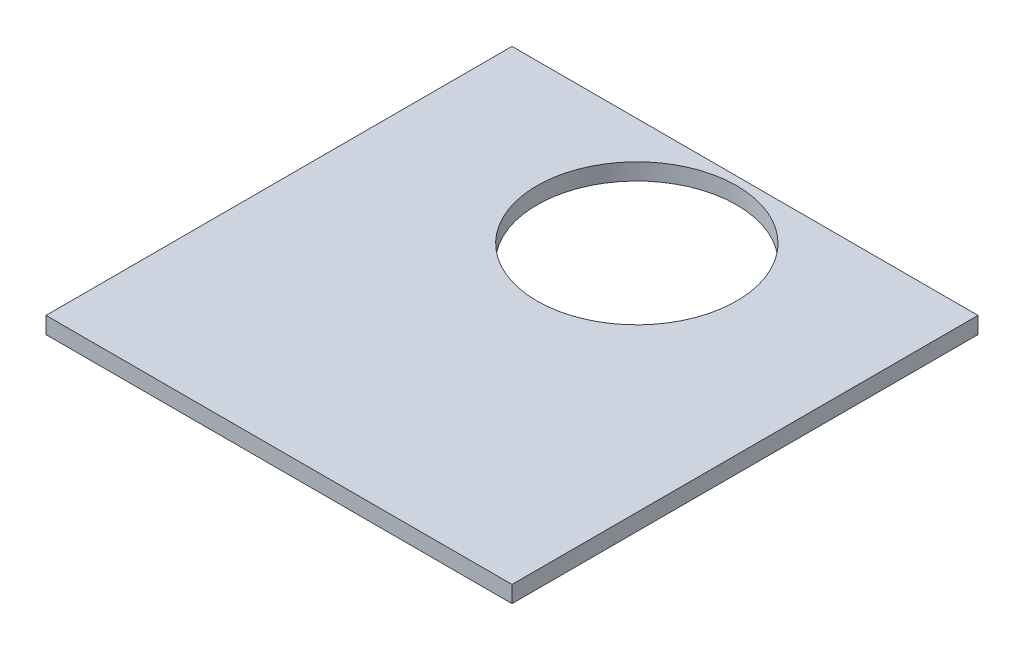
from build123d import *

# Parameters (mm, degrees)
SKETCH1_W           = 71.12
SKETCH1_H           = 71.12
BOSS_EXTRUDE1_DEPTH = 2.54
SKETCH2_R           = 15.24
CUT_EXTRUDE1_DEPTH  = 15.748


with BuildPart() as part:
    # Sketch1 → Boss-Extrude1 (new body)
    with BuildSketch(Plane(origin=(0, 0, 0), x_dir=(1, 0, 0), z_dir=(0, 1, 0))):
        with Locations((10.146850495, 4.656355231)):
            Rectangle(SKETCH1_W, SKETCH1_H)
    extrude(amount=-BOSS_EXTRUDE1_DEPTH)

    # Sketch2 → Cut-Extrude1 (cut)
    with BuildSketch(Plane(origin=(0, 0, 0), x_dir=(1, 0, 0), z_dir=(0, 1, 0))):
        with Locations(Location((10.146850495, 23.706355231, 0), (0, 0, 270))):
            Circle(SKETCH2_R)
    extrude(amount=-CUT_EXTRUDE1_DEPTH, mode=Mode.SUBTRACT)


solid = part.part
